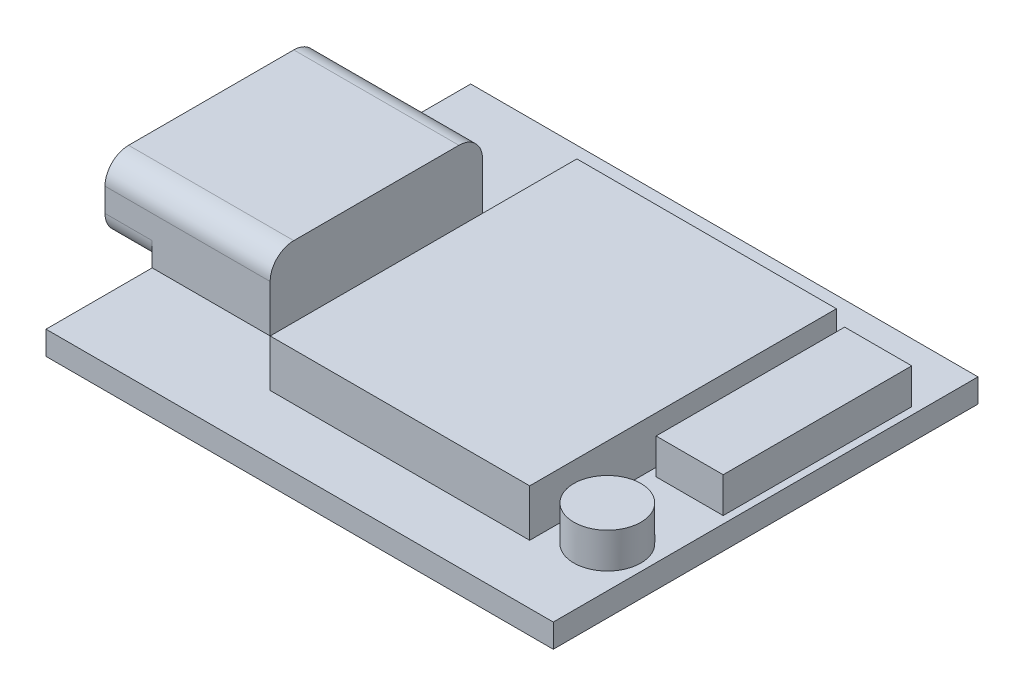
from build123d import *

# Parameters (mm, degrees)
SKETCH1_W           = 21.5
SKETCH1_H           = 18
BOSS_EXTRUDE1_DEPTH = 1
SKETCH2_W           = 7
SKETCH2_H           = 9
BOSS_EXTRUDE2_DEPTH = 3
FILLET1_R           = 1
SKETCH3_W           = 11
SKETCH3_H           = 13
BOSS_EXTRUDE3_DEPTH = 2
SKETCH4_R           = 1.421484938
SKETCH4_W           = 2.842969875
SKETCH4_H           = 7.991681725
BOSS_EXTRUDE5_DEPTH = 1.5


with BuildPart() as part:
    # Sketch1 → Boss-Extrude1 (new body)
    with BuildSketch(Plane(origin=(0, 0, 0), x_dir=(1, 0, 0), z_dir=(0, 1, 0))):
        Rectangle(SKETCH1_W, SKETCH1_H)
    extrude(amount=BOSS_EXTRUDE1_DEPTH)

    # Sketch2 → Boss-Extrude2 (add)
    with BuildSketch(Plane(origin=(0, 1, 0), x_dir=(1, 0, 0), z_dir=(0, 1, 0))):
        with Locations((-9.25, 0)):
            Rectangle(SKETCH2_W, SKETCH2_H)
    extrude(amount=BOSS_EXTRUDE2_DEPTH)

    # Fillet1
    fillet1_edges = [part.edges().sort_by_distance(p)[0] for p in [
        (-11.75, 1, 4.5),
        (-11.75, 1, -4.5),
        (-9.25, 4, 4.5),
        (-9.25, 4, -4.5),
    ]]
    fillet(fillet1_edges, radius=FILLET1_R)

    # Sketch3 → Boss-Extrude3 (add)
    with BuildSketch(Plane(origin=(0, 1, 0), x_dir=(1, 0, 0), z_dir=(0, 1, 0))):
        with Locations((1.75, 0)):
            Rectangle(SKETCH3_W, SKETCH3_H)
    extrude(amount=BOSS_EXTRUDE3_DEPTH)

    # Sketch4 → Boss-Extrude5 (add)
    with BuildSketch(Plane(origin=(0, 1, 0), x_dir=(1, 0, 0), z_dir=(0, 1, 0))):
        with Locations(Location((9.020591351, -4.978400633, 0), (0, 0, 90))):
            Circle(SKETCH4_R)
        with Locations((9.020591352, 2.504159137)):
            Rectangle(SKETCH4_W, SKETCH4_H)
    extrude(amount=BOSS_EXTRUDE5_DEPTH)


solid = part.part
